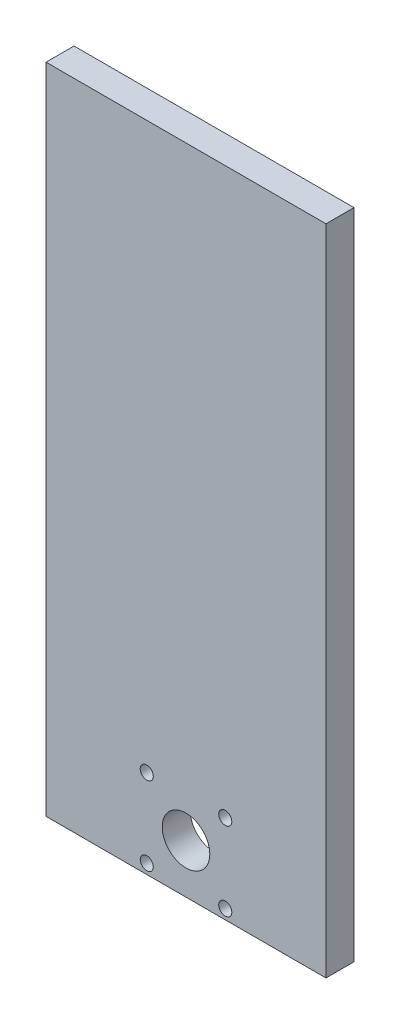
from build123d import *

# Parameters (mm, degrees)
MAINBODY_EXTRUDE_START            = -1.5
PROJECTIONXY_SKETCH_W             = 30
PROJECTIONXY_SKETCH_H             = 70
MAINBODY_EXTRUDE_DEPTH            = 3
BORE_CUT_DEPTH                    = 39.108398025
BORE_CUT_DEPTH_BACK               = 39.108398025
BORE_SKETCH_R                     = 2.55
POSTCLEARANCEHOLES_CUT_DEPTH      = 39.108398025
POSTCLEARANCEHOLES_CUT_DEPTH_BACK = 39.108398025
POSTCLEARANCEHOLES_SKETCH_R       = 0.7


with BuildPart() as part:
    # projectionXy_sketch → mainBody_extrude (new body)
    with BuildSketch(Plane.XY.offset(MAINBODY_EXTRUDE_START)):
        Rectangle(PROJECTIONXY_SKETCH_W, PROJECTIONXY_SKETCH_H)
    extrude(amount=MAINBODY_EXTRUDE_DEPTH)

    # bore_sketch → bore_cut (cut, two sides: drawn at the far end of the back side and taken through both)
    with BuildSketch(Plane.XY.offset(-BORE_CUT_DEPTH_BACK)):
        with Locations((0, -29.742714652)):
            Circle(BORE_SKETCH_R)
    extrude(amount=BORE_CUT_DEPTH + BORE_CUT_DEPTH_BACK, mode=Mode.SUBTRACT)

    # postClearanceHoles_sketch → postClearanceHoles_cut (cut, two sides: drawn at the far end of the back side and taken through both)
    with BuildSketch(Plane.XY.offset(-POSTCLEARANCEHOLES_CUT_DEPTH_BACK)):
        with Locations((4.207285348, -25.535429304)):
            Circle(POSTCLEARANCEHOLES_SKETCH_R)
        with Locations((-4.207285348, -25.535429304)):
            Circle(POSTCLEARANCEHOLES_SKETCH_R)
        with Locations((-4.207285348, -33.95)):
            Circle(POSTCLEARANCEHOLES_SKETCH_R)
        with Locations((4.207285348, -33.95)):
            Circle(POSTCLEARANCEHOLES_SKETCH_R)
    extrude(amount=POSTCLEARANCEHOLES_CUT_DEPTH + POSTCLEARANCEHOLES_CUT_DEPTH_BACK, mode=Mode.SUBTRACT)


solid = part.part
